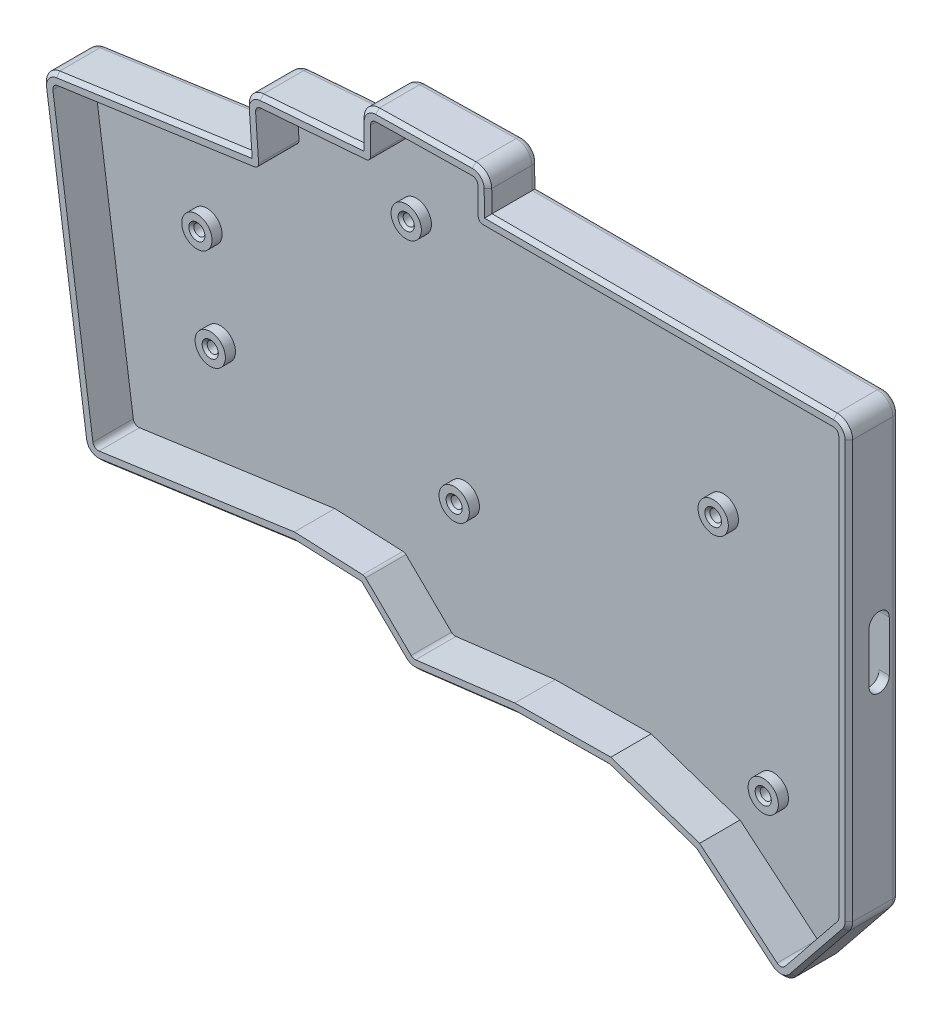
from build123d import *

# Parameters (mm, degrees)
BOSS_EXTRUDE1_DEPTH = 2
BOSS_EXTRUDE2_DEPTH = 10
SKETCH7_R           = 3
SKETCH7_R_2         = 1.100094
SKETCH7_R_3         = 1.100095
SKETCH7_R_4         = 1.14540164
SKETCH7_R_5         = 1.100094267
BOSS_EXTRUDE3_DEPTH = 4
CUT_EXTRUDE1_DEPTH  = 3
FILLET2_R           = 1.3
CHAMFER1_SIZE       = 0.75
CHAMFER2_SIZE       = 0.5


with BuildPart() as part:
    # Sketch3 → Boss-Extrude1 (new body)
    with BuildSketch(Plane.XY):
        with BuildLine():
            Line((60.855233133, 23.823211938), (47.949977192, 24.377676222))
            Line((47.949977192, 24.377676222), (9.438001399, 18.932389733))
            ThreePointArc((9.438001399, 18.932389733), (7.157815869, 19.520564151), (5.962231275, 21.549300871))
            Line((5.962231275, 21.549300871), (-1.970708405, 77.995680607))
            ThreePointArc((-1.970708405, 77.995680607), (-1.383464331, 80.271537635), (0.639738461, 81.467794829))
            Line((0.639738461, 81.467794829), (38.699898469, 86.902208152))
            Line((38.699898469, 86.902208152), (38.171393284, 94.460167157))
            ThreePointArc((38.171393284, 94.460167157), (38.910984807, 96.683773594), (41.002517903, 97.740613468))
            Line((41.002517903, 97.740613468), (60.921819416, 99.276682226))
            Line((60.921819416, 99.276682226), (60.921819416, 103.721902307))
            ThreePointArc((60.921819416, 103.721902307), (61.804499235, 105.878127499), (63.945786912, 106.796450874))
            Line((63.945786912, 106.796450874), (83.059551455, 107.113531682))
            ThreePointArc((83.059551455, 107.113531682), (85.251859467, 106.245869167), (86.185286941, 104.080744272))
            Line((86.185286941, 104.080744272), (86.24375422, 99.780452187))
            Line((86.24375422, 99.780452187), (154.596820419, 99.780452187))
            ThreePointArc((154.596820419, 99.780452187), (156.771169517, 98.879807301), (157.671814403, 96.705458202))
            Line((157.671814403, 96.705458202), (157.671814403, 14.057773112))
            ThreePointArc((157.671814403, 14.057773112), (157.497078938, 13.035997261), (156.992732263, 12.130352296))
            Line((156.992732263, 12.130352296), (146.547659954, -0.852593653))
            ThreePointArc((146.547659954, -0.852593653), (144.453525054, -1.98521487), (142.178510717, -1.283401812))
            Line((142.178510717, -1.283401812), (127.110775499, 11.324099062))
            Line((127.110775499, 11.324099062), (110.204782414, 17.079131321))
            Line((110.204782414, 17.079131321), (91.635796855, 16.870620568))
            Line((91.635796855, 16.870620568), (72.085555936, 14.46343429))
            ThreePointArc((72.085555936, 14.46343429), (70.725838171, 14.602041008), (69.560483965, 15.316179508))
            Line((69.560483965, 15.316179508), (60.855233133, 23.823211938))
        make_face()
    extrude(amount=BOSS_EXTRUDE1_DEPTH)

    # Sketch4 → Boss-Extrude2 (add)
    with BuildSketch(Plane.XY):
        with BuildLine():
            Line((47.949977192, 24.377676222), (60.855233133, 23.823211938))
            Line((60.855233133, 23.823211938), (69.560483965, 15.316179508))
            ThreePointArc((69.560483965, 15.316179508), (70.725838171, 14.602041008), (72.085555936, 14.46343429))
            Line((72.085555936, 14.46343429), (91.635796855, 16.870620568))
            Line((91.635796855, 16.870620568), (110.204782414, 17.079131321))
            Line((110.204782414, 17.079131321), (127.110775499, 11.324099062))
            Line((127.110775499, 11.324099062), (142.178510717, -1.283401812))
            ThreePointArc((142.178510717, -1.283401812), (144.453525054, -1.98521487), (146.547659954, -0.852593653))
            Line((146.547659954, -0.852593653), (156.992732263, 12.130352296))
            ThreePointArc((156.992732263, 12.130352296), (157.497078938, 13.035997261), (157.671814403, 14.057773112))
            Line((157.671814403, 14.057773112), (157.671814403, 96.705458202))
            ThreePointArc((157.671814403, 96.705458202), (156.771169517, 98.879807301), (154.596820419, 99.780452187))
            Line((154.596820419, 99.780452187), (86.24375422, 99.780452187))
            Line((86.24375422, 99.780452187), (86.185286941, 104.080744272))
            ThreePointArc((86.185286941, 104.080744272), (85.251859467, 106.245869167), (83.059551455, 107.113531682))
            Line((83.059551455, 107.113531682), (63.945786912, 106.796450874))
            ThreePointArc((63.945786912, 106.796450874), (61.804499235, 105.878127499), (60.921819416, 103.721902307))
            Line((60.921819416, 103.721902307), (60.921819416, 99.276682226))
            Line((60.921819416, 99.276682226), (41.002517903, 97.740613468))
            ThreePointArc((41.002517903, 97.740613468), (38.910984807, 96.683773594), (38.171393284, 94.460167157))
            Line((38.171393284, 94.460167157), (38.699898469, 86.902208152))
            Line((38.699898469, 86.902208152), (0.639738461, 81.467794829))
            ThreePointArc((0.639738461, 81.467794829), (-1.383464331, 80.271537635), (-1.970708405, 77.995680607))
            Line((-1.970708405, 77.995680607), (5.962231275, 21.549300871))
            ThreePointArc((5.962231275, 21.549300871), (7.157815869, 19.520564151), (9.438001399, 18.932389733))
            Line((9.438001399, 18.932389733), (47.949977192, 24.377676222))
        make_face()
        with BuildLine():
            ThreePointArc((84.258355662, 98.692914663), (84.533669024, 98.04695842), (85.183308419, 97.780452187))
            Line((85.183308419, 97.780452187), (154.596820419, 97.780452187))
            ThreePointArc((154.596820419, 97.780452187), (155.356955955, 97.465593738), (155.671814403, 96.705458202))
            Line((155.671814403, 96.705458202), (155.671814403, 14.057773112))
            ThreePointArc((155.671814403, 14.057773112), (155.610734868, 13.70060696), (155.434438315, 13.38403486))
            Line((155.434438315, 13.38403486), (144.989366006, 0.401088911))
            ThreePointArc((144.989366006, 0.401088911), (144.257272174, 0.005133041), (143.461944249, 0.250481615))
            Line((143.461944249, 0.250481615), (128.108249423, 13.097251096))
            Line((128.108249423, 13.097251096), (110.524936275, 19.082852408))
            Line((110.524936275, 19.082852408), (91.501949272, 18.869243682))
            Line((91.501949272, 18.869243682), (71.841145237, 16.448443965))
            ThreePointArc((71.841145237, 16.448443965), (71.365754809, 16.496904248), (70.958318613, 16.74658445))
            Line((70.958318613, 16.74658445), (61.958856362, 25.54112911))
            ThreePointArc((61.958856362, 25.54112911), (61.679828995, 25.728441638), (61.352295386, 25.803701118))
            Line((61.352295386, 25.803701118), (47.852081394, 26.383727313))
            Line((47.852081394, 26.383727313), (9.158002316, 20.91269287))
            ThreePointArc((9.158002316, 20.91269287), (8.360780393, 21.118336461), (7.942767807, 21.827644264))
            Line((7.942767807, 21.827644264), (0.009828128, 78.274024))
            ThreePointArc((0.009828128, 78.274024), (0.215128769, 79.069664055), (0.922440855, 79.487875801))
            Line((0.922440855, 79.487875801), (39.972806225, 85.063675424))
            ThreePointArc((39.972806225, 85.063675424), (40.561555536, 85.398058084), (40.76480024, 86.043913413))
            Line((40.76480024, 86.043913413), (40.166521363, 94.599680421))
            ThreePointArc((40.166521363, 94.599680421), (40.425084652, 95.377059525), (41.156290542, 95.746533736))
            Line((41.156290542, 95.746533736), (62.067941403, 97.359127107))
            ThreePointArc((62.067941403, 97.359127107), (62.675544492, 97.652931317), (62.921819416, 98.281303094))
            Line((62.921819416, 98.281303094), (62.921819416, 103.721902307))
            ThreePointArc((62.921819416, 103.721902307), (63.230393236, 104.475691655), (63.978960617, 104.796726017))
            Line((63.978960617, 104.796726017), (83.09272516, 105.113806824))
            ThreePointArc((83.09272516, 105.113806824), (83.859148665, 104.810474928), (84.185471769, 104.053554549))
            Line((84.185471769, 104.053554549), (84.258355662, 98.692914663))
        make_face(mode=Mode.SUBTRACT)
    extrude(amount=BOSS_EXTRUDE2_DEPTH)

    # Sketch7 → Boss-Extrude3 (add)
    # profile 1 of 6: a face of its own
    with BuildSketch(Plane.XY):
        with Locations((25.178343626, 43.435558637)):
            Circle(SKETCH7_R)
        with Locations((25.178343626, 43.435558637)):
            Circle(SKETCH7_R_2, mode=Mode.SUBTRACT)
    # profile 2 of 6: a face of its own
    with BuildSketch(Plane.XY):
        with Locations((22.534055897, 62.250653675)):
            Circle(SKETCH7_R)
        with Locations((22.534055897, 62.250653675)):
            Circle(SKETCH7_R_2, mode=Mode.SUBTRACT)
    # profile 3 of 6: a face of its own
    with BuildSketch(Plane.XY):
        with Locations((63.99681822, 84.705447078)):
            Circle(SKETCH7_R)
        with Locations((63.99681822, 84.705447078)):
            Circle(SKETCH7_R_3, mode=Mode.SUBTRACT)
    # profile 4 of 6: a face of its own
    with BuildSketch(Plane.XY):
        with Locations((73.496822591, 41.005447941)):
            Circle(SKETCH7_R)
        with Locations((73.496822591, 41.005447941)):
            Circle(SKETCH7_R_3, mode=Mode.SUBTRACT)
    # profile 5 of 6: a face of its own
    with BuildSketch(Plane.XY):
        with Locations((124.796820928, 64.405450202)):
            Circle(SKETCH7_R)
        with Locations((124.796820928, 64.405450202)):
            Circle(SKETCH7_R_4, mode=Mode.SUBTRACT)
    # profile 6 of 6: a face of its own
    with BuildSketch(Plane.XY):
        with Locations((134.70931431, 21.546419059)):
            Circle(SKETCH7_R)
        with Locations((134.70931431, 21.546419059)):
            Circle(SKETCH7_R_5, mode=Mode.SUBTRACT)
    extrude(amount=BOSS_EXTRUDE3_DEPTH)

    # Sketch8 → Cut-Extrude1 (cut)
    with BuildSketch(Plane(origin=(157.671814403, 0, 0), x_dir=(0, 0, -1), z_dir=(1, 0, 0))):
        with BuildLine():
            Line((-2, 62.669458202), (-2, 52.669458202))
            ThreePointArc((-2, 52.669458202), (-4, 50.669458202), (-6, 52.669458202))
            Line((-6, 52.669458202), (-6, 62.669458202))
            ThreePointArc((-6, 62.669458202), (-4, 64.669458202), (-2, 62.669458202))
        make_face()
    extrude(amount=-CUT_EXTRUDE1_DEPTH, mode=Mode.SUBTRACT)

    # Fillet2
    fillet2_edges = [part.edges().sort_by_distance(p)[0] for p in [
        (65.207858549, 19.569695723, 0),
        (54.402605163, 24.10044408, 0),
        (28.693989296, 21.655032978, 0),
        (7.157815869, 19.520564151, 0),
        (1.995761435, 49.772490739, 0),
        (-1.383464331, 80.271537635, 0),
        (19.669818465, 84.18500149, 0),
        (38.435645877, 90.681187654, 0),
        (38.910984807, 96.683773594, 0),
        (50.962168659, 98.508647847, 0),
        (60.921819416, 101.499292266, 0),
        (61.804499235, 105.878127499, 0),
        (73.502669184, 106.954991278, 0),
        (85.251859467, 106.245869167, 0),
        (86.21452058, 101.930598229, 0),
        (120.420287319, 99.780452187, 0),
        (156.771169517, 98.879807301, 0),
        (157.671814403, 55.381615657, 0),
        (157.497078938, 13.035997261, 0),
        (151.770196108, 5.638879321, 0),
        (144.453525054, -1.98521487, 0),
        (134.644643108, 5.020348625, 0),
        (118.657778957, 14.201615191, 0),
        (100.920289635, 16.974875944, 0),
        (81.860676395, 15.667027429, 0),
        (70.725838171, 14.602041008, 0),
    ]]
    fillet(fillet2_edges, radius=FILLET2_R)

    # Chamfer1
    chamfer1_edges = [part.edges().sort_by_distance(p)[0] for p in [
        (70.725838171, 14.602041008, 10),
        (81.860676395, 15.667027429, 10),
        (100.920289635, 16.974875944, 10),
        (118.657778957, 14.201615191, 10),
        (134.644643108, 5.020348625, 10),
        (144.453525054, -1.98521487, 10),
        (151.770196108, 5.638879321, 10),
        (157.497078938, 13.035997261, 10),
        (157.671814403, 55.381615657, 10),
        (156.771169517, 98.879807301, 10),
        (120.420287319, 99.780452187, 10),
        (86.21452058, 101.930598229, 10),
        (85.251859467, 106.245869167, 10),
        (73.502669184, 106.954991278, 10),
        (61.804499235, 105.878127499, 10),
        (60.921819416, 101.499292266, 10),
        (50.962168659, 98.508647847, 10),
        (38.910984807, 96.683773594, 10),
        (38.435645877, 90.681187654, 10),
        (19.669818465, 84.18500149, 10),
        (-1.383464331, 80.271537635, 10),
        (1.995761435, 49.772490739, 10),
        (7.157815869, 19.520564151, 10),
        (28.693989296, 21.655032978, 10),
        (54.402605163, 24.10044408, 10),
        (65.207858549, 19.569695723, 10),
    ]]
    chamfer(chamfer1_edges, length=CHAMFER1_SIZE)

    # Chamfer2
    chamfer2_edges = [part.edges().sort_by_distance(p)[0] for p in [
        (133.609220043, 21.546419059, 4),
        (123.651419288, 64.405450202, 4),
        (72.396727591, 41.005447941, 4),
        (62.89672322, 84.705447078, 4),
        (21.433961897, 62.250653675, 4),
        (24.078249626, 43.435558637, 4),
    ]]
    chamfer(chamfer2_edges, length=CHAMFER2_SIZE)


solid = part.part
